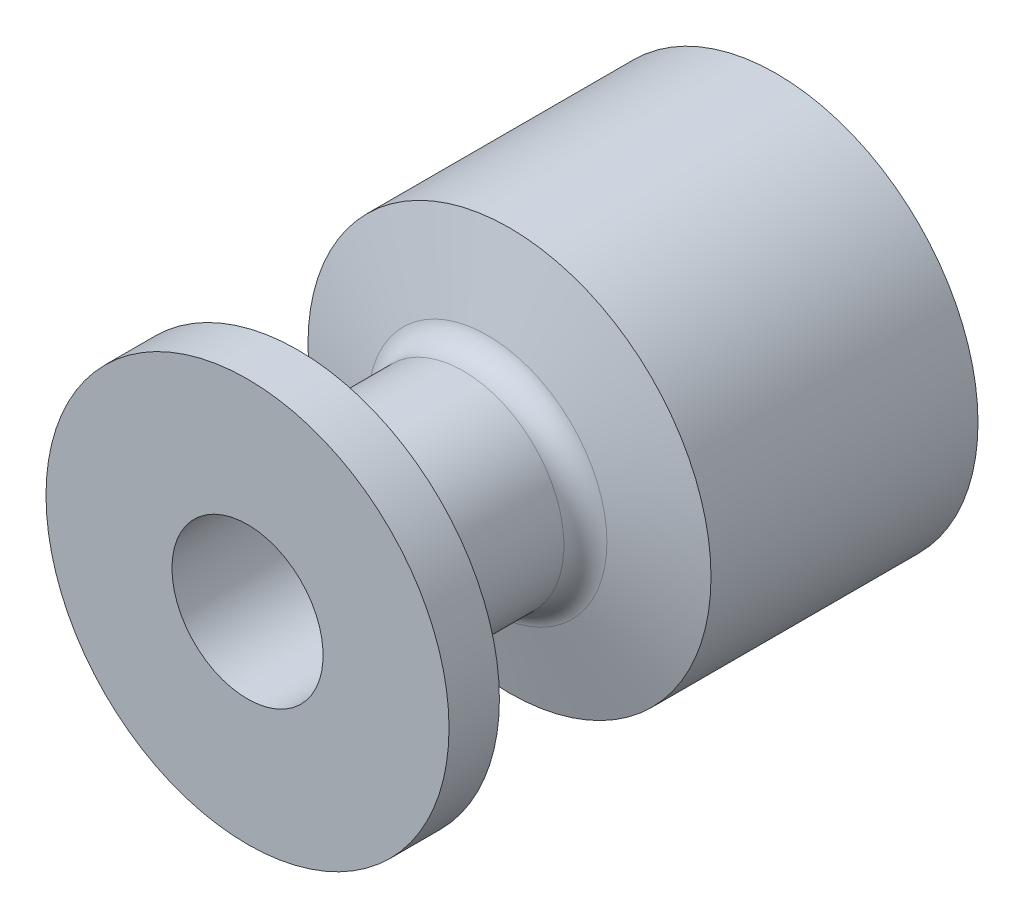
from build123d import *

# Parameters (mm, degrees)
SKETCH_1_R      = 4
SKETCH_1_R_2    = 1.5
EXTRUDE_1_DEPTH = 10.5
FILLET_1_R      = 0.5


with BuildPart() as part:
    # 草图1 → 凸台-拉伸1 (new body)
    with BuildSketch(Plane.XY):
        with Locations(Location((0, 0, 0), (0, 0, 180))):
            Circle(SKETCH_1_R)
        with Locations(Location((0, 0, 0), (0, 0, 180))):
            Circle(SKETCH_1_R_2, mode=Mode.SUBTRACT)
    extrude(amount=EXTRUDE_1_DEPTH)

    # 草图3 → 切除-旋转1 (revolve, cut)
    with BuildSketch(Plane(origin=(0, 0, 0), x_dir=(1, 0, 0), z_dir=(0, 1, 0))):
        Polygon((-3.624639835, 0), (-2.85, -0.65), (0, -0.65), (0, 0), align=None)
        Polygon((-4, -5.3), (-4, -9.5), (-2, -8.850160608), (-2, -5.835898385), align=None)
    revolve(axis=Axis((0, 0, 0), (0, 0, 1)), mode=Mode.SUBTRACT)

    # 圆角1
    fillet_1_edges = [part.edges().sort_by_distance(p)[0] for p in [
        (2, 0, 5.835898385),
        (2, 0, 8.850160608),
    ]]
    fillet(fillet_1_edges, radius=FILLET_1_R)


solid = part.part
